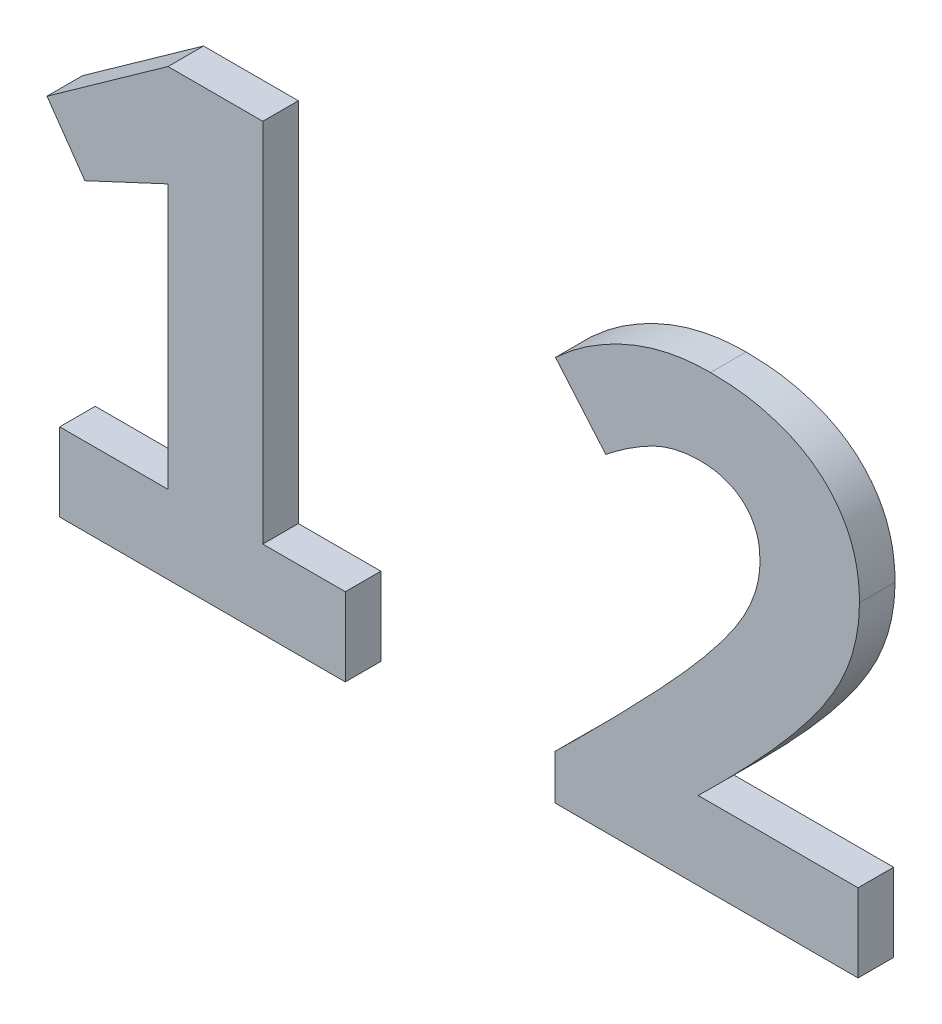
from build123d import *

# Parameters (mm, degrees)
BOSS_EXTRUDE1_DEPTH   = 2
BOSS_EXTRUDE1_2_DEPTH = 2


with BuildPart() as part:
    # Sketch1 → Boss-Extrude1 (new body)
    with BuildSketch(Plane.XY):
        Polygon((14.285714286, 4.397321429), (18.928571429, 4.397321429), (18.928571429, 0), (2.857142857, 0), (2.857142857, 4.397321429), (8.962053571, 4.397321429), (8.962053571, 19.285714286), (4.274553571, 17.098214286), (2.142857143, 20.150669643), (8.950892857, 25), (14.285714286, 25), align=None)
    extrude(amount=BOSS_EXTRUDE1_DEPTH)


with BuildPart() as body_2:
    # Sketch1 → Boss-Extrude1 2 (new body)
    with BuildSketch(Plane.XY):
        with BuildLine():
            add(Edge.make_bspline(
                [(47.857142857, 18.325892857), (47.847047534, 18.012830167), (47.826751332, 17.383431451), (47.674148464, 16.441662045), (47.436095787, 15.500544925), (47.148999973, 14.723932176), (46.869509729, 14.095290404), (46.615389998, 13.603154729), (46.327158781, 13.092923803), (45.999781168, 12.565350665), (45.639932301, 12.01977426), (45.233860548, 11.460605883), (44.794078589, 10.882536146), (44.31845441, 10.281314918), (43.793150417, 9.65983538), (43.227946795, 9.001415766), (42.605172536, 8.317688691), (41.941963322, 7.593464234), (41.220638893, 6.844908491), (40.456719198, 6.053800209), (39.635971612, 5.237506304), (39.072019005, 4.681693631), (38.783482143, 4.397321429)],
                knots=[0, 0, 0, 0, 1.100845728, 2.213201733, 3.347907492, 4.511248748, 5.120476086, 5.767201514, 6.458686229, 7.18141409, 7.950881571, 8.757165455, 9.611732629, 10.505889173, 11.453421634, 12.47400406, 13.558095852, 14.706472467, 15.928260719, 17.214641761, 18.574918322, 20, 20, 20, 20], degree=3))
            Line((38.783482143, 4.397321429), (47.779017857, 4.397321429))
            Line((47.779017857, 4.397321429), (47.779017857, 0))
            Line((47.779017857, 0), (30.714285714, 0))
            Line((30.714285714, 0), (30.714285714, 2.505580357))
            add(Edge.make_bspline(
                [(30.714285714, 2.505580357), (31.100426691, 2.883944098), (31.850151795, 3.618569044), (32.922874669, 4.70546958), (33.937536251, 5.718408892), (34.872825911, 6.678610029), (35.738486379, 7.576411744), (36.532789018, 8.415358595), (37.255412919, 9.192143973), (37.909682031, 9.914412986), (38.505036488, 10.586168331), (39.048471859, 11.224183356), (39.542265693, 11.829711518), (39.992862365, 12.401080248), (40.393165264, 12.941898648), (40.751720815, 13.44774961), (41.060086703, 13.921839221), (41.396813444, 14.500653833), (41.740905878, 15.189178222), (42.041357198, 16.000005567), (42.224254087, 16.783212094), (42.252136589, 17.296388938), (42.265625, 17.544642857)],
                knots=[0, 0, 0, 0, 1.681103221, 3.264002948, 4.748739028, 6.139491879, 7.432217462, 8.626994239, 9.732096377, 10.731303213, 11.65745276, 12.52327445, 13.337248416, 14.087077573, 14.785837962, 15.429360383, 16.014983106, 16.543770616, 17.511265766, 18.404271926, 19.228052177, 20, 20, 20, 20], degree=3))
            add(Edge.make_bspline(
                [(42.265625, 17.544642857), (42.256124323, 17.787523525), (42.238034005, 18.249994614), (42.068441924, 18.903133056), (41.780635072, 19.469158017), (41.375049612, 19.94064117), (40.869969067, 20.315250274), (40.270179536, 20.57511319), (39.586891153, 20.743641808), (39.100808352, 20.757311357), (38.844866071, 20.764508929)],
                knots=[0, 0, 0, 0, 1.091714092, 2.078741832, 3.011202065, 3.925746218, 4.853495407, 5.816725453, 6.850417529, 8, 8, 8, 8], degree=3))
            add(Edge.make_bspline(
                [(38.844866071, 20.764508929), (38.624905773, 20.756565074), (38.184074037, 20.740644459), (37.530834948, 20.624924792), (36.887808861, 20.441157592), (36.256632782, 20.171734146), (35.621929913, 19.82858859), (34.961319782, 19.426081071), (34.275889482, 18.950083724), (33.819133759, 18.597680839), (33.582589286, 18.415178571)],
                knots=[0, 0, 0, 0, 0.897777216, 1.79927328, 2.700641362, 3.623136151, 4.594842017, 5.644701961, 6.78023918, 8, 8, 8, 8], degree=3))
            Line((33.582589286, 18.415178571), (30.753348214, 21.729910714))
            add(Edge.make_bspline(
                [(30.753348214, 21.729910714), (31.060875059, 22.003904683), (31.67230514, 22.54866413), (32.674101368, 23.253953044), (33.721113812, 23.878535413), (34.816629606, 24.406522088), (35.948237456, 24.834944769), (37.108081926, 25.135628197), (38.288297416, 25.320899854), (39.082297636, 25.34502683), (39.481026786, 25.357142857)],
                knots=[0, 0, 0, 0, 1.021144944, 2.030257671, 3.033836159, 4.043170469, 5.043507399, 6.030771669, 7.011097581, 8, 8, 8, 8], degree=3))
            add(Edge.make_bspline(
                [(39.481026786, 25.357142857), (39.877563018, 25.346773512), (40.648996813, 25.326600668), (41.772254713, 25.191229072), (42.820728649, 24.940408171), (43.801766004, 24.612145809), (44.696653356, 24.178492697), (45.500154687, 23.64294789), (46.194322052, 22.994943197), (46.690606914, 22.377002931), (47.033315791, 21.840152465), (47.248392226, 21.405468006), (47.442331033, 20.955004121), (47.58952913, 20.474813406), (47.716279717, 19.972977407), (47.795434729, 19.443962246), (47.848401189, 18.892456496), (47.854184649, 18.517619783), (47.857142857, 18.325892857)],
                knots=[0, 0, 0, 0, 1.537755779, 2.991597445, 4.377277701, 5.711696503, 6.995623783, 8.221973749, 9.441836677, 10.662957162, 11.285333074, 11.907917941, 12.541560989, 13.184860494, 13.853150981, 14.546882282, 15.256738248, 16, 16, 16, 16], degree=3))
        make_face()
    extrude(amount=BOSS_EXTRUDE1_2_DEPTH)


solid = Compound([part.part, body_2.part])
